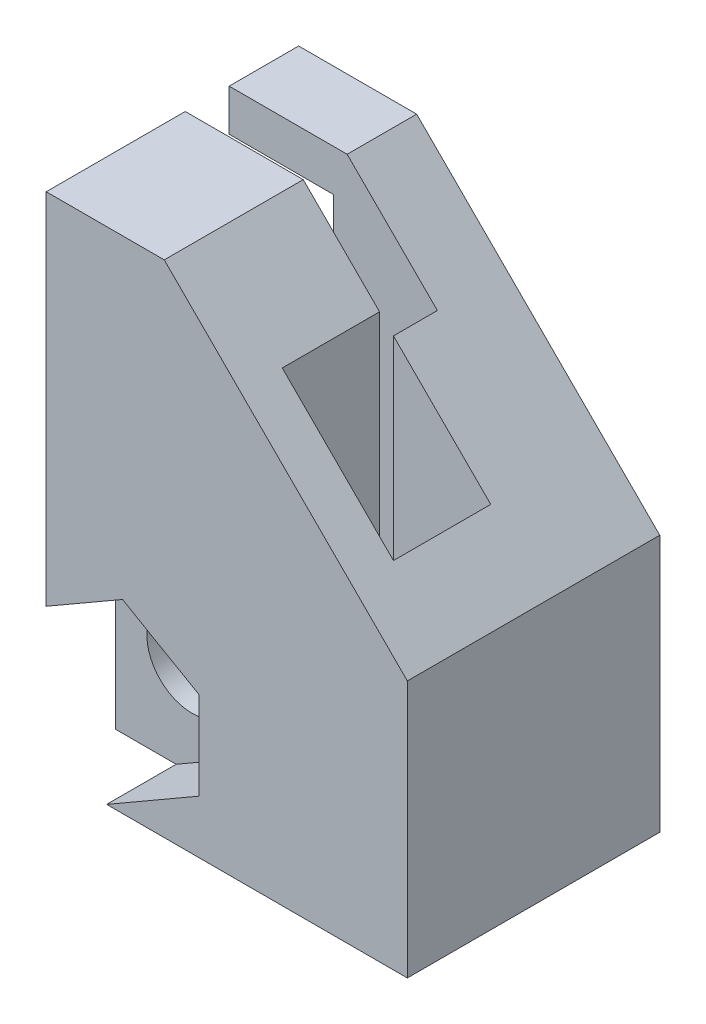
from build123d import *

# Parameters (mm, degrees)
CROQUIS2_R              = 1.625
SALIENTE_EXTRUIR1_DEPTH = 2.5
CROQUIS4_R              = 3.35997123
CORTAR_EXTRUIR1_DEPTH   = 1.8
CORTAR_EXTRUIR1_DRAFT   = -44
SALIENTE_EXTRUIR2_DEPTH = 1.58
SALIENTE_EXTRUIR3_START = 3.5
CROQUIS6_R              = 1.625
SALIENTE_EXTRUIR3_DEPTH = 3.5
CROQUIS9_R              = 1.625
SALIENTE_EXTRUIR5_DEPTH = 1.5
CORTAR_EXTRUIR2_DEPTH   = 2.5


with BuildPart() as part:
    # Croquis2 → Saliente-Extruir1 (new body)
    with BuildSketch(Plane(origin=(0, 0, -1.58), x_dir=(-1, 0, 0), z_dir=(0, 0, -1))):
        Polygon((-199.99984, -57.999935), (-197.99984, -55.999935), (-193.75453947, -55.999935), (-193.75453947, -57.499935), (-197.50453947, -57.499935), (-197.50453947, -64.74523553), (-192.49984, -64.74523553), (-192.49984, -73.999935), (-206.74514053, -73.999935), (-206.74514053, -64.74523553), align=None)
        with Locations((-196.49984, -70.499935)):
            Circle(CROQUIS2_R, mode=Mode.SUBTRACT)
    extrude(amount=SALIENTE_EXTRUIR1_DEPTH)


with BuildPart() as cortar_extruir1_tool:
    # Croquis4 → Cortar-Extruir1 (with draft: the straight prism first)
    with BuildSketch(Plane(origin=(0, 0, -4.08), x_dir=(-1, 0, 0), z_dir=(0, 0, -1))):
        with Locations((-196.49984, -70.499935)):
            Circle(CROQUIS4_R)
    extrude(amount=-CORTAR_EXTRUIR1_DEPTH)
    # Cortar-Extruir1: the draft: its side faces are tilted about the plane it starts from
    cortar_extruir1_sides = [cortar_extruir1_tool.faces().sort_by_distance(p)[0] for p in [
        (199.85981123, -70.499935, -3.18),
    ]]
    draft(cortar_extruir1_sides, Plane(origin=(0, 0, -4.08), x_dir=(-1, 0, 0), z_dir=(0, 0, -1)), CORTAR_EXTRUIR1_DRAFT)


with BuildPart() as part_1:
    add(part.part)

    # Cortar-Extruir1: cut by cortar_extruir1_tool
    add(cortar_extruir1_tool.part, mode=Mode.SUBTRACT)

    # Croquis5 → Saliente-Extruir2 (add)
    with BuildSketch(Plane.XY.offset(-1.58)):
        Polygon((206.74514053, -73.999935), (201.24514053, -73.999935), (201.24514053, -59.24523553), (206.74514053, -64.74523553), align=None)
    extrude(amount=SALIENTE_EXTRUIR2_DEPTH)

    # Croquis6 → Saliente-Extruir3 (add)
    # profile 1 of 2: a face of its own
    with BuildSketch(Plane.XY.offset(SALIENTE_EXTRUIR3_START)):
        Polygon((193.75453947, -55.999935), (193.75453947, -73.999935), (200.74514053, -73.999935), (200.74514053, -58.74523553), (197.99984, -55.999935), align=None)
        with Locations((196.49984, -70.499935)):
            Circle(CROQUIS6_R, mode=Mode.SUBTRACT)
    # profile 2 of 2: a face of its own
    with BuildSketch(Plane.XY.offset(SALIENTE_EXTRUIR3_START)):
        Polygon((206.74514053, -73.999935), (204.74514053, -73.999935), (204.74514053, -62.74523553), (206.74514053, -64.74523553), align=None)
    extrude(amount=-SALIENTE_EXTRUIR3_DEPTH)


with BuildPart() as saliente_extruir3_piece_1:
    # of the separate pieces the step leaves, piece 1, a body of its own (saliente_extruir3_pieces)
    add(part_1.part.solids().sort_by_distance((197.99984, -55.999935, -1.58))[0])



with BuildPart() as saliente_extruir3_piece_2:
    # of the separate pieces the step leaves, piece 2, a body of its own (saliente_extruir3_pieces)
    add(part_1.part.solids().sort_by_distance((193.75453947, -55.999935, 3.5))[0])


with BuildPart() as saliente_extruir3_piece_1_1:
    add(saliente_extruir3_piece_1.part)

    add(saliente_extruir3_piece_2.part)  # Saliente-Extruir5 merges Saliente-Extruir3 piece 2
    # Croquis9 → Saliente-Extruir5 (add)
    with BuildSketch(Plane.XY.offset(3.5)):
        Polygon((193.75453947, -55.999935), (197.99984, -55.999935), (206.74514053, -64.74523553), (206.74514053, -73.999935), (193.75453947, -73.999935), align=None)
        with Locations((196.49984, -70.499935)):
            Circle(CROQUIS9_R, mode=Mode.SUBTRACT)
    extrude(amount=SALIENTE_EXTRUIR5_DEPTH)

    # Croquis10 → Cortar-Extruir2 (cut)
    with BuildSketch(Plane.XY.offset(5)):
        Polygon((196.49984, -67.329935), (193.75453947, -68.914935), (193.75453947, -70.499935), (193.75453947, -73.999935), (195.928263234, -73.999935), (196.49984, -73.669935), (199.24514053, -72.084935), (199.24514053, -68.914935), align=None)
    extrude(amount=-CORTAR_EXTRUIR2_DEPTH, mode=Mode.SUBTRACT)


solid = saliente_extruir3_piece_1_1.part
